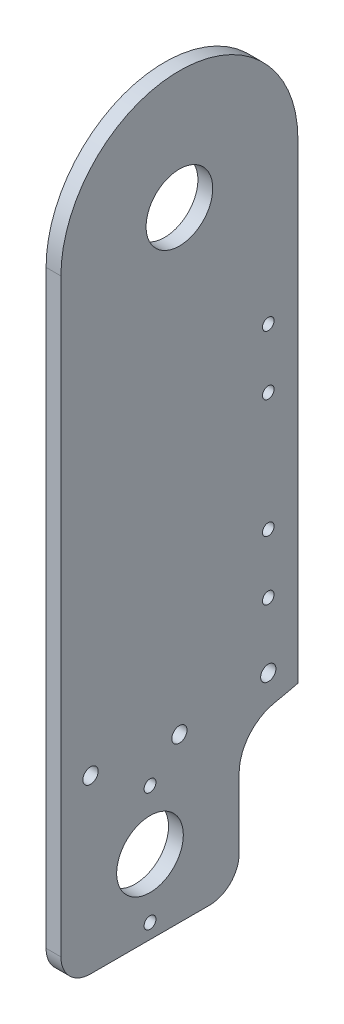
from build123d import *

# Parameters (mm, degrees)
SKETCH1_R                           = 14.2875
BOSS_EXTRUDE1_DEPTH                 = 6.35
F_0_257_DIAMETER_HOLE1_D            = 6.5278
F_9_0_2_DIAMETER_HOLE1_D            = 5.08
FILLET2_R                           = 12.7
FILLET1_R                           = 19.05
F_9_0_196_DIAMETER_HOLE1_AT_2_COUNT = 2
F_9_0_196_DIAMETER_HOLE1_AT_2_PITCH = 25.4
F_9_0_196_DIAMETER_HOLE1_AT_3_COUNT = 2
F_9_0_196_DIAMETER_HOLE1_AT_3_PITCH = 76.2
F_9_0_196_DIAMETER_HOLE1_AT_4_COUNT = 2
F_9_0_196_DIAMETER_HOLE1_AT_4_PITCH = 101.6


with BuildPart() as part:
    # Sketch1 → Boss-Extrude1 (new body)
    with BuildSketch(Plane.YZ):
        with BuildLine():
            Line((0, -50.8), (-201.989896777, -50.8))
            ThreePointArc((-201.989896777, -50.8), (-204.733971085, -38.269563411), (-206.701492618, -25.593970963))
            Line((-206.701492618, -25.593970963), (-265.489896777, -25.593970963))
            Line((-265.489896777, -25.593970963), (-265.489896777, 50.8))
            Line((-265.489896777, 50.8), (-201.989896777, 50.8))
            Line((-201.989896777, 50.8), (0, 50.8))
            ThreePointArc((0, 50.8), (50.8, 0), (0, -50.8))
        make_face()
        with Locations(Location((0, 0, 0), (0, 0, 270))):
            Circle(SKETCH1_R, mode=Mode.SUBTRACT)
        with Locations(Location((-233.739896777, 12.603014519, 0), (0, 0, 270))):
            Circle(SKETCH1_R, mode=Mode.SUBTRACT)
    extrude(amount=BOSS_EXTRUDE1_DEPTH)

    # F (0.257) Diameter Hole1 (through all)
    with Locations(Plane.YZ.offset(6.35)):
        with Locations((0, 0), (-191.833069099, -38.1), (-195.58, 0), (-191.833069099, 38.1)):
            Hole(F_0_257_DIAMETER_HOLE1_D / 2)

    # #9 (0.2) Diameter Hole1 (through all)
    with Locations(Plane.YZ.offset(6.35)):
        with Locations((-259.139896777, 12.603014519), (-208.339896777, 12.603014519)):
            Hole(F_9_0_2_DIAMETER_HOLE1_D / 2)

    # Fillet2
    fillet2_edges = [part.edges().sort_by_distance(p)[0] for p in [
        (3.175, -265.489896777, -25.593970963),
        (3.175, -265.489896777, 50.8),
    ]]
    fillet(fillet2_edges, radius=FILLET2_R)

    # Fillet1
    fillet1_edges = [part.edges().sort_by_distance(p)[0] for p in [
        (3.175, -206.701492618, -25.593970963),
    ]]
    fillet(fillet1_edges, radius=FILLET1_R)

    # Sketch9 → #9 (0.196) Diameter Hole1 (revolve, cut)
    with BuildSketch(Plane(origin=(6.35, -163.889896777, -38.1), x_dir=(0, 0, -1), z_dir=(0, 1, 0))):
        Polygon((0, 0), (0, 6.35), (4.7625, 6.35), (2.4892, 4.0767), (2.4892, 0), align=None)
    f_9_0_196_diameter_hole1 = revolve(axis=Axis((12.7, -163.889896777, -38.1), (-1, 0, 0)), mode=Mode.SUBTRACT)

    # #9 (0.196) Diameter Hole1 at 2: #9 (0.196) Diameter Hole1 ×2
    with Locations(*[(0, i * F_9_0_196_DIAMETER_HOLE1_AT_2_PITCH, 0) for i in range(1, F_9_0_196_DIAMETER_HOLE1_AT_2_COUNT)]):
        add(f_9_0_196_diameter_hole1, mode=Mode.SUBTRACT)

    # #9 (0.196) Diameter Hole1 at 3: #9 (0.196) Diameter Hole1 ×2
    with Locations(*[(0, i * F_9_0_196_DIAMETER_HOLE1_AT_3_PITCH, 0) for i in range(1, F_9_0_196_DIAMETER_HOLE1_AT_3_COUNT)]):
        add(f_9_0_196_diameter_hole1, mode=Mode.SUBTRACT)

    # #9 (0.196) Diameter Hole1 at 4: #9 (0.196) Diameter Hole1 ×2
    with Locations(*[(0, i * F_9_0_196_DIAMETER_HOLE1_AT_4_PITCH, 0) for i in range(1, F_9_0_196_DIAMETER_HOLE1_AT_4_COUNT)]):
        add(f_9_0_196_diameter_hole1, mode=Mode.SUBTRACT)


solid = part.part
